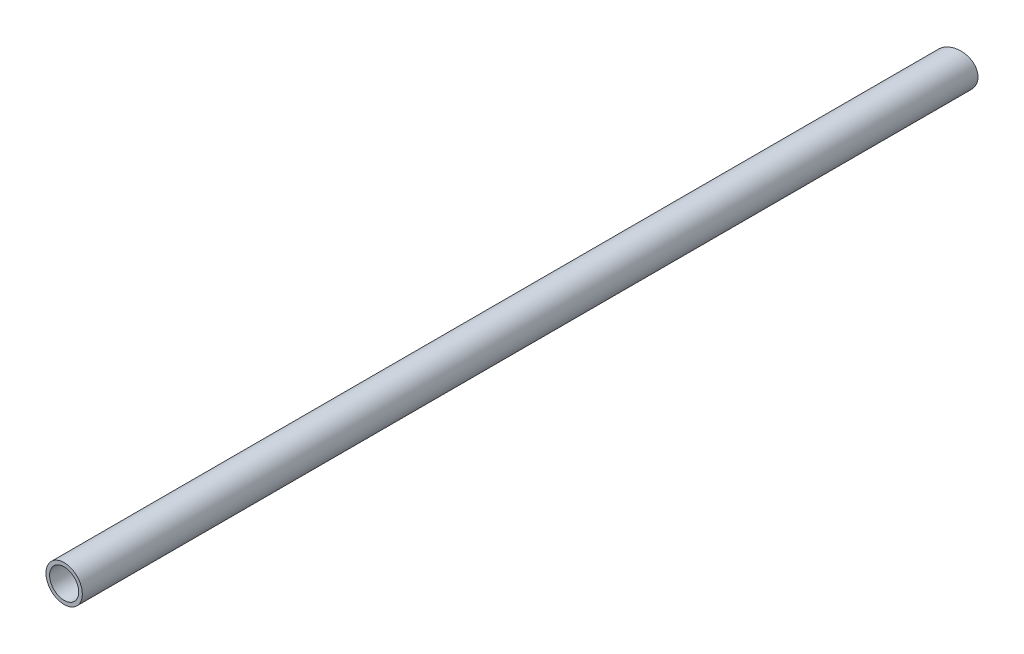
from build123d import *

# Parameters (mm, degrees)
SKETCH1_R               = 15.875
SKETCH1_R_2             = 12.7
BOSS_EXTRUDE1_DEPTH     = 782.32
CUT_EXTRUDE1_DEPTH      = 783.642072502
CUT_EXTRUDE1_DEPTH_BACK = 783.642072502


with BuildPart() as part:
    # Sketch1 → Boss-Extrude1 (new body)
    with BuildSketch(Plane.XY):
        Circle(SKETCH1_R)
        Circle(SKETCH1_R_2, mode=Mode.SUBTRACT)
    extrude(amount=BOSS_EXTRUDE1_DEPTH)

    # Sketch3 → Cut-Extrude1 (cut, two sides: drawn at the far end of the back side and taken through both)
    with BuildSketch(Plane(origin=(0, 0, 0), x_dir=(1, 0, 0), z_dir=(0, 1, 0)).offset(-CUT_EXTRUDE1_DEPTH_BACK)):
        Polygon((0, 0), (15.875, 0), (-47.625, -17.014773719), (-47.625, 0), align=None)
    extrude(amount=CUT_EXTRUDE1_DEPTH + CUT_EXTRUDE1_DEPTH_BACK, mode=Mode.SUBTRACT)


solid = part.part
